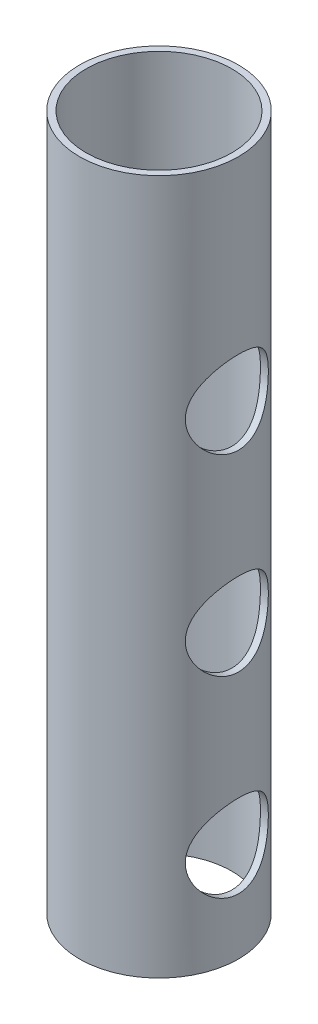
from build123d import *

# Parameters (mm, degrees)
SKETCH1_R           = 24
SKETCH1_R_2         = 22
BOSS_EXTRUDE1_DEPTH = 209.8
SKETCH2_R           = 12.53
CUT_EXTRUDE1_DEPTH  = 213.527739366


with BuildPart() as part:
    # Sketch1 → Boss-Extrude1 (new body)
    with BuildSketch(Plane(origin=(0, 0, 0), x_dir=(1, 0, 0), z_dir=(0, 1, 0))):
        with Locations(Location((0, 0, 0), (0, 0, 270))):
            Circle(SKETCH1_R)
        with Locations(Location((0, 0, 0), (0, 0, 270))):
            Circle(SKETCH1_R_2, mode=Mode.SUBTRACT)
    extrude(amount=BOSS_EXTRUDE1_DEPTH)

    # Sketch2 → Cut-Extrude1 (cut, through all)
    with BuildSketch(Plane(origin=(0, 0, 0), x_dir=(0, 0, -1), z_dir=(1, 0, 0))):
        with Locations(Location((0, 145.6, 0), (0, 0, 180))):
            Circle(SKETCH2_R)
        with Locations(Location((0, 87.6, 0), (0, 0, 180))):
            Circle(SKETCH2_R)
        with Locations(Location((0, 29.6, 0), (0, 0, 180))):
            Circle(SKETCH2_R)
    extrude(amount=CUT_EXTRUDE1_DEPTH, mode=Mode.SUBTRACT)


solid = part.part
